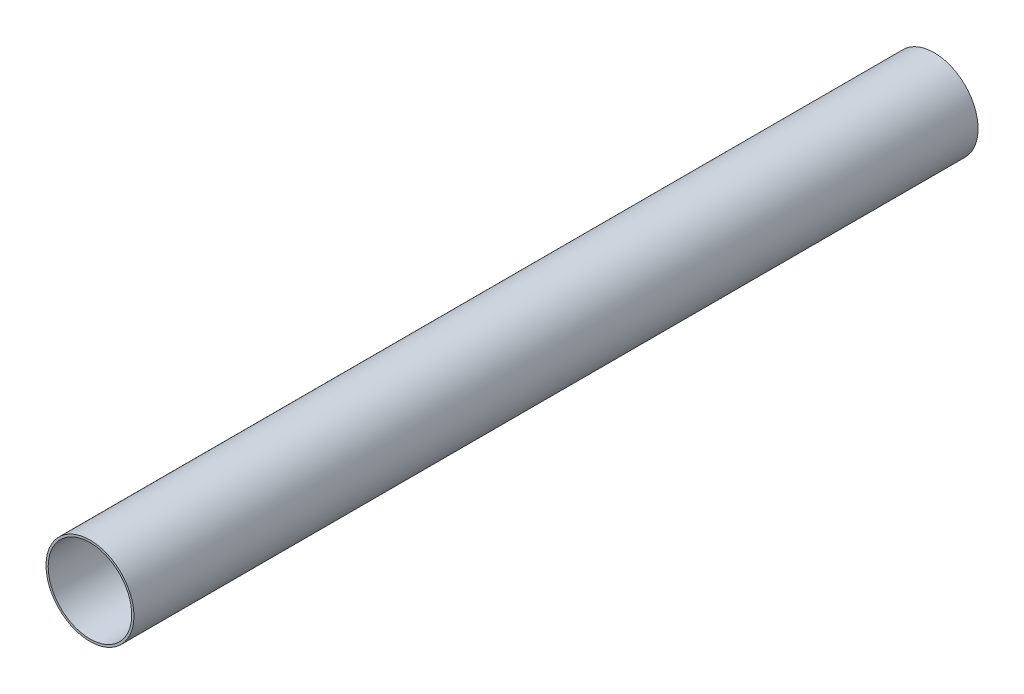
from build123d import *

# Parameters (mm, degrees)
SKETCH1_R           = 31.75
SKETCH1_R_2         = 30.1625
BOSS_EXTRUDE1_DEPTH = 609.6


with BuildPart() as part:
    # Sketch1 → Boss-Extrude1 (new body)
    with BuildSketch(Plane.XY):
        with Locations(Location((0, 0, 0), (0, 0, 180))):
            Circle(SKETCH1_R)
        with Locations(Location((0, 0, 0), (0, 0, 180))):
            Circle(SKETCH1_R_2, mode=Mode.SUBTRACT)
    extrude(amount=BOSS_EXTRUDE1_DEPTH)


solid = part.part
